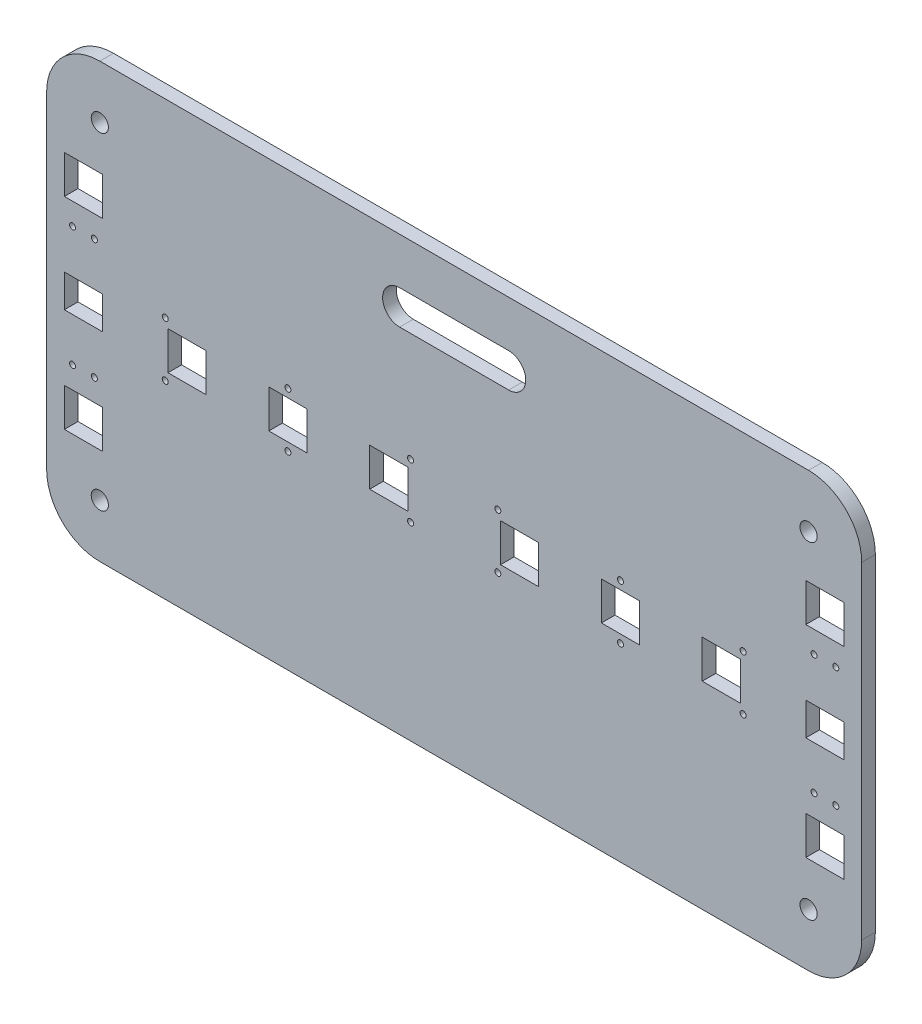
from build123d import *

# Parameters (mm, degrees)
SKETCH_2_R      = 3.15
SKETCH_2_R_2    = 1.1
SKETCH_2_W      = 14
SKETCH_2_H      = 14
SKETCH_2_H_2    = 12
EXTRUDE_1_DEPTH = 5


with BuildPart() as part:
    # 草图2 → 凸台-拉伸1 (new body)
    with BuildSketch(Plane.XY):
        with BuildLine():
            Line((-130, 29.5), (130, 29.5))
            ThreePointArc((130, 29.5), (143.788582233, 23.788582233), (149.5, 10))
            Line((149.5, 10), (149.5, -110))
            ThreePointArc((149.5, -110), (143.788582233, -123.788582233), (130, -129.5))
            Line((130, -129.5), (-130, -129.5))
            ThreePointArc((-130, -129.5), (-143.788582233, -123.788582233), (-149.5, -110))
            Line((-149.5, -110), (-149.5, 10))
            ThreePointArc((-149.5, 10), (-143.788582233, 23.788582233), (-130, 29.5))
        make_face()
        with Locations((130, -110)):
            Circle(SKETCH_2_R, mode=Mode.SUBTRACT)
        with Locations((130, 10)):
            Circle(SKETCH_2_R, mode=Mode.SUBTRACT)
        with Locations((-130, -110)):
            Circle(SKETCH_2_R, mode=Mode.SUBTRACT)
        with Locations((-130, 10)):
            Circle(SKETCH_2_R, mode=Mode.SUBTRACT)
        with Locations((-106, -40)):
            Circle(SKETCH_2_R_2, mode=Mode.SUBTRACT)
        with Locations((-106, -60)):
            Circle(SKETCH_2_R_2, mode=Mode.SUBTRACT)
        with Locations((-16, -40)):
            Circle(SKETCH_2_R_2, mode=Mode.SUBTRACT)
        with Locations((-16, -60)):
            Circle(SKETCH_2_R_2, mode=Mode.SUBTRACT)
        with Locations((-61, -60)):
            Circle(SKETCH_2_R_2, mode=Mode.SUBTRACT)
        with Locations((-61, -40)):
            Circle(SKETCH_2_R_2, mode=Mode.SUBTRACT)
        with Locations(Location((16, -60, 0), (0, 0, 180))):
            Circle(SKETCH_2_R_2, mode=Mode.SUBTRACT)
        with Locations(Location((16, -40, 0), (0, 0, 180))):
            Circle(SKETCH_2_R_2, mode=Mode.SUBTRACT)
        with Locations(Location((61, -60, 0), (0, 0, 180))):
            Circle(SKETCH_2_R_2, mode=Mode.SUBTRACT)
        with Locations(Location((61, -40, 0), (0, 0, 180))):
            Circle(SKETCH_2_R_2, mode=Mode.SUBTRACT)
        with Locations(Location((106, -60, 0), (0, 0, 180))):
            Circle(SKETCH_2_R_2, mode=Mode.SUBTRACT)
        with Locations(Location((106, -40, 0), (0, 0, 180))):
            Circle(SKETCH_2_R_2, mode=Mode.SUBTRACT)
        with Locations((140, -28)):
            Circle(SKETCH_2_R_2, mode=Mode.SUBTRACT)
        with Locations((132, -28)):
            Circle(SKETCH_2_R_2, mode=Mode.SUBTRACT)
        with Locations((132, -72)):
            Circle(SKETCH_2_R_2, mode=Mode.SUBTRACT)
        with Locations((140, -72)):
            Circle(SKETCH_2_R_2, mode=Mode.SUBTRACT)
        with Locations(Location((-140, -72, 0), (0, 0, 180))):
            Circle(SKETCH_2_R_2, mode=Mode.SUBTRACT)
        with Locations(Location((-132, -72, 0), (0, 0, 180))):
            Circle(SKETCH_2_R_2, mode=Mode.SUBTRACT)
        with Locations(Location((-132, -28, 0), (0, 0, 180))):
            Circle(SKETCH_2_R_2, mode=Mode.SUBTRACT)
        with Locations(Location((-140, -28, 0), (0, 0, 180))):
            Circle(SKETCH_2_R_2, mode=Mode.SUBTRACT)
        with Locations((-61, -50)):
            Rectangle(SKETCH_2_W, SKETCH_2_H, mode=Mode.SUBTRACT)
        with Locations((-24, -50)):
            Rectangle(SKETCH_2_W, SKETCH_2_H, mode=Mode.SUBTRACT)
        with Locations((24, -50)):
            Rectangle(SKETCH_2_W, SKETCH_2_H, mode=Mode.SUBTRACT)
        with Locations((136, -87)):
            Rectangle(SKETCH_2_W, SKETCH_2_H, mode=Mode.SUBTRACT)
        with Locations((136, -13)):
            Rectangle(SKETCH_2_W, SKETCH_2_H, mode=Mode.SUBTRACT)
        with BuildLine():
            Line((-20, 12.5), (20, 12.5))
            ThreePointArc((20, 12.5), (26.25, 6.25), (20, 0))
            Line((20, 0), (-20, 0))
            ThreePointArc((-20, 0), (-26.25, 6.25), (-20, 12.5))
        make_face(mode=Mode.SUBTRACT)
        with Locations((-136, -87)):
            Rectangle(SKETCH_2_W, SKETCH_2_H, mode=Mode.SUBTRACT)
        with Locations((-136, -13)):
            Rectangle(SKETCH_2_W, SKETCH_2_H, mode=Mode.SUBTRACT)
        with Locations((-98, -50)):
            Rectangle(SKETCH_2_W, SKETCH_2_H, mode=Mode.SUBTRACT)
        with Locations((61, -50)):
            Rectangle(SKETCH_2_W, SKETCH_2_H, mode=Mode.SUBTRACT)
        with Locations((98, -50)):
            Rectangle(SKETCH_2_W, SKETCH_2_H, mode=Mode.SUBTRACT)
        with Locations((-136, -50)):
            Rectangle(SKETCH_2_W, SKETCH_2_H_2, mode=Mode.SUBTRACT)
        with Locations((136, -50)):
            Rectangle(SKETCH_2_W, SKETCH_2_H_2, mode=Mode.SUBTRACT)
    extrude(amount=EXTRUDE_1_DEPTH)


solid = part.part
